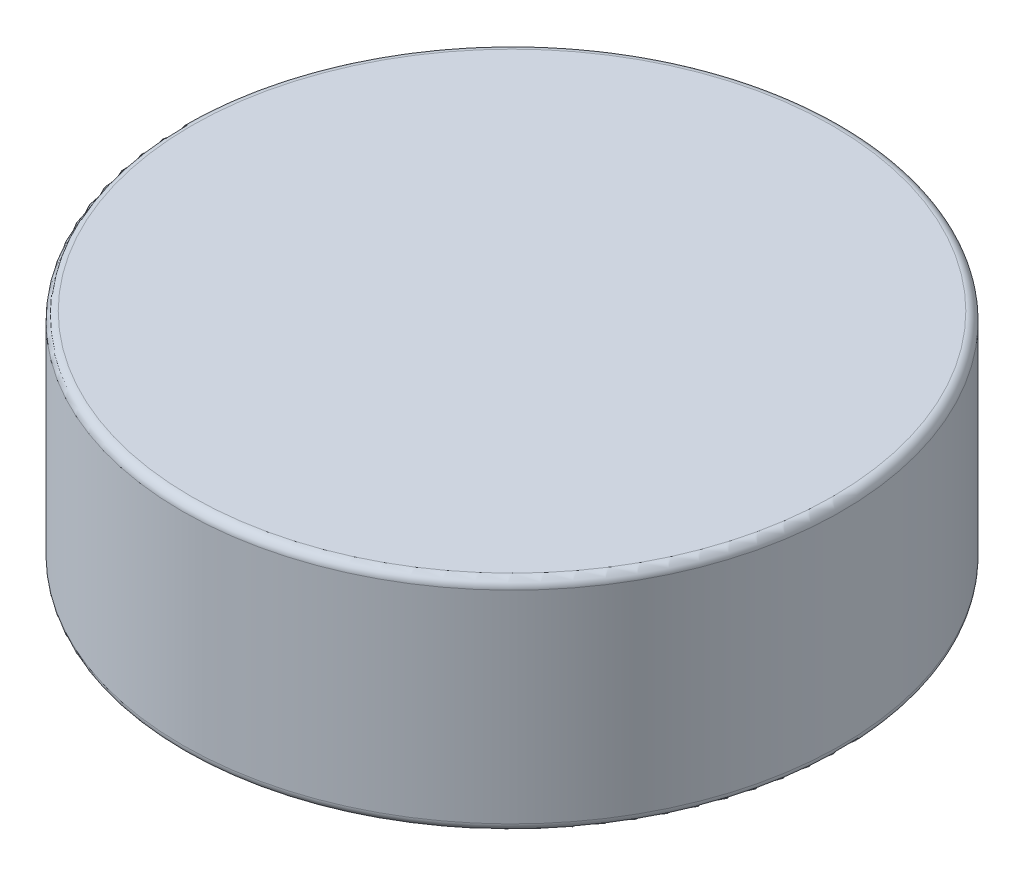
from build123d import *

# Parameters (mm, degrees)
ESQUISSE1_R        = 38.1
BOSS_EXTRU_1_DEPTH = 12.7
CONG_1_R           = 1


with BuildPart() as part:
    # Esquisse1 → Boss.-Extru.1 (new, symmetric)
    with BuildSketch(Plane(origin=(0, 0, 0), x_dir=(1, 0, 0), z_dir=(0, 1, 0))):
        with Locations(Location((0, 0, 0), (0, 0, 270))):
            Circle(ESQUISSE1_R)
    extrude(amount=BOSS_EXTRU_1_DEPTH, both=True)

    # Congé1
    cong_1_edges = [part.edges().sort_by_distance(p)[0] for p in [
        (0, -12.7, -38.1),
        (0, 12.7, -38.1),
    ]]
    fillet(cong_1_edges, radius=CONG_1_R)


solid = part.part
